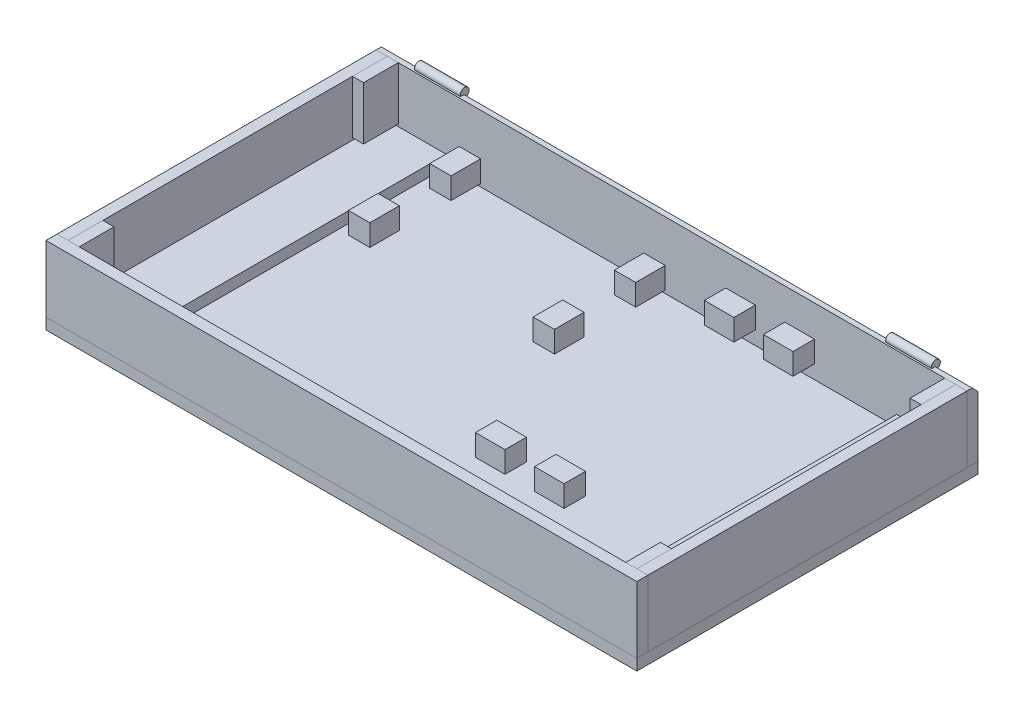
from build123d import *

# Parameters (mm, degrees)
ESQUISSE1_W             = 800
ESQUISSE1_H             = 462
BOSS_EXTRU_1_DEPTH      = 15
ESQUISSE3_W             = 800
ESQUISSE3_H             = 15
BOSS_EXTRU_3_DEPTH      = 90
BOSS_EXTRU_3_2_DEPTH    = 90
ESQUISSE4_W             = 15
ESQUISSE4_H             = 432
BOSS_EXTRU_4_DEPTH      = 90
BOSS_EXTRU_4_2_DEPTH    = 90
ESQUISSE5_W             = 15
ESQUISSE5_H             = 47
BOSS_EXTRU_5_DEPTH      = 72
BOSS_EXTRU_5_2_DEPTH    = 72
BOSS_EXTRU_5_3_DEPTH    = 72
BOSS_EXTRU_5_4_DEPTH    = 72
ESQUISSE7_W             = 80
ESQUISSE7_H             = 432
BOSS_EXTRU_6_DEPTH      = 15
BOSS_EXTRU_6_2_DEPTH    = 15
BOSS_EXTRU_7_START      = -50
ESQUISSE8_R             = 6
BOSS_EXTRU_7_DEPTH      = 62
CHANFREIN1_SIZE         = 8
ESQUISSE9_W             = 120
ESQUISSE9_H             = 29
BOSS_EXTRU_8_DEPTH      = 29
BOSS_EXTRU_8_2_DEPTH    = 29
ESQUISSE9_W_2           = 29
ESQUISSE9_H_2           = 150
BOSS_EXTRU_8_3_DEPTH    = 29
BOSS_EXTRU_8_4_DEPTH    = 29
ESQUISSE10_W            = 279
ESQUISSE10_H            = 70
ESQUISSE10_W_2          = 40
ESQUISSE10_H_2          = 339
ENL_V_MAT_EXTRU_1_DEPTH = 479.264571132


with BuildPart() as part:
    # Esquisse1 → Boss.-Extru.1 (new body)
    with BuildSketch(Plane(origin=(0, 0, 0), x_dir=(1, 0, 0), z_dir=(0, 1, 0))):
        Rectangle(ESQUISSE1_W, ESQUISSE1_H)
    extrude(amount=BOSS_EXTRU_1_DEPTH)


with BuildPart() as body_2:
    # Esquisse3 → Boss.-Extru.3 (new body)
    with BuildSketch(Plane(origin=(0, 15, 0), x_dir=(1, 0, 0), z_dir=(0, 1, 0))):
        with Locations((0, 223.5)):
            Rectangle(ESQUISSE3_W, ESQUISSE3_H)
    extrude(amount=BOSS_EXTRU_3_DEPTH)

    # Chanfrein1
    chanfrein1_edges = [body_2.edges().sort_by_distance(p)[0] for p in [
        (0, 105, -231),
    ]]
    chamfer(chanfrein1_edges, length=CHANFREIN1_SIZE)


with BuildPart() as body_3:
    # Esquisse3 → Boss.-Extru.3 2 (new body)
    with BuildSketch(Plane(origin=(0, 15, 0), x_dir=(1, 0, 0), z_dir=(0, 1, 0))):
        with Locations((0, -223.5)):
            Rectangle(ESQUISSE3_W, ESQUISSE3_H)
    extrude(amount=BOSS_EXTRU_3_2_DEPTH)


with BuildPart() as body_4:
    # Esquisse4 → Boss.-Extru.4 (new body)
    with BuildSketch(Plane(origin=(0, 15, 0), x_dir=(1, 0, 0), z_dir=(0, 1, 0))):
        with Locations((-392.5, 0)):
            Rectangle(ESQUISSE4_W, ESQUISSE4_H)
    extrude(amount=BOSS_EXTRU_4_DEPTH)


with BuildPart() as body_5:
    # Esquisse4 → Boss.-Extru.4 2 (new body)
    with BuildSketch(Plane(origin=(0, 15, 0), x_dir=(1, 0, 0), z_dir=(0, 1, 0))):
        with Locations((392.5, 0)):
            Rectangle(ESQUISSE4_W, ESQUISSE4_H)
    extrude(amount=BOSS_EXTRU_4_2_DEPTH)


with BuildPart() as body_6:
    # Esquisse5 → Boss.-Extru.5 (new body)
    with BuildSketch(Plane(origin=(0, 105, 0), x_dir=(1, 0, 0), z_dir=(0, 1, 0))):
        with Locations((-377.5, 192.5)):
            Rectangle(ESQUISSE5_W, ESQUISSE5_H)
    extrude(amount=-BOSS_EXTRU_5_DEPTH)


with BuildPart() as body_7:
    # Esquisse5 → Boss.-Extru.5 2 (new body)
    with BuildSketch(Plane(origin=(0, 105, 0), x_dir=(1, 0, 0), z_dir=(0, 1, 0))):
        with Locations((-377.5, -192.5)):
            Rectangle(ESQUISSE5_W, ESQUISSE5_H)
    extrude(amount=-BOSS_EXTRU_5_2_DEPTH)


with BuildPart() as body_8:
    # Esquisse5 → Boss.-Extru.5 3 (new body)
    with BuildSketch(Plane(origin=(0, 105, 0), x_dir=(1, 0, 0), z_dir=(0, 1, 0))):
        with Locations((377.5, -192.5)):
            Rectangle(ESQUISSE5_W, ESQUISSE5_H)
    extrude(amount=-BOSS_EXTRU_5_3_DEPTH)


with BuildPart() as body_9:
    # Esquisse5 → Boss.-Extru.5 4 (new body)
    with BuildSketch(Plane(origin=(0, 105, 0), x_dir=(1, 0, 0), z_dir=(0, 1, 0))):
        with Locations((377.5, 192.5)):
            Rectangle(ESQUISSE5_W, ESQUISSE5_H)
    extrude(amount=-BOSS_EXTRU_5_4_DEPTH)


with BuildPart() as body_10:
    # Esquisse7 → Boss.-Extru.6 (new body)
    with BuildSketch(Plane(origin=(0, 15, 0), x_dir=(1, 0, 0), z_dir=(0, 1, 0))):
        with Locations((-345, 0)):
            Rectangle(ESQUISSE7_W, ESQUISSE7_H)
    extrude(amount=BOSS_EXTRU_6_DEPTH)


with BuildPart() as body_11:
    # Esquisse7 → Boss.-Extru.6 2 (new body)
    with BuildSketch(Plane(origin=(0, 15, 0), x_dir=(1, 0, 0), z_dir=(0, 1, 0))):
        with Locations((345, 0)):
            Rectangle(ESQUISSE7_W, ESQUISSE7_H)
    extrude(amount=BOSS_EXTRU_6_2_DEPTH)


with BuildPart() as body_12:
    # Esquisse8 → Boss.-Extru.7 (new body)
    with BuildSketch(Plane.ZY.offset(400).offset(BOSS_EXTRU_7_START)):
        with Locations((-224, 107)):
            Circle(ESQUISSE8_R)
    extrude(amount=-BOSS_EXTRU_7_DEPTH)


with BuildPart() as body_13:
    # Symétrie3: mirrored copy
    add(body_12.part.mirror(Plane(origin=(0, 0, 0), x_dir=(0, 0, 1), z_dir=(1, 0, 0))))


with BuildPart() as body_14:
    # Esquisse9 → Boss.-Extru.8 (new body)
    with BuildSketch(Plane(origin=(0, 15, 0), x_dir=(1, 0, 0), z_dir=(0, 1, 0))):
        with Locations((195, 140)):
            Rectangle(ESQUISSE9_W, ESQUISSE9_H)
    extrude(amount=BOSS_EXTRU_8_DEPTH)


with BuildPart() as body_15:
    # Esquisse9 → Boss.-Extru.8 2 (new body)
    with BuildSketch(Plane(origin=(0, 15, 0), x_dir=(1, 0, 0), z_dir=(0, 1, 0))):
        with Locations((195, -170)):
            Rectangle(ESQUISSE9_W, ESQUISSE9_H)
    extrude(amount=BOSS_EXTRU_8_2_DEPTH)


with BuildPart() as body_16:
    # Esquisse9 → Boss.-Extru.8 3 (new body)
    with BuildSketch(Plane(origin=(0, 15, 0), x_dir=(1, 0, 0), z_dir=(0, 1, 0))):
        with Locations((-197, 65)):
            Rectangle(ESQUISSE9_W_2, ESQUISSE9_H_2)
    extrude(amount=BOSS_EXTRU_8_3_DEPTH)


with BuildPart() as body_17:
    # Esquisse9 → Boss.-Extru.8 4 (new body)
    with BuildSketch(Plane(origin=(0, 15, 0), x_dir=(1, 0, 0), z_dir=(0, 1, 0))):
        with Locations((53, 65)):
            Rectangle(ESQUISSE9_W_2, ESQUISSE9_H_2)
    extrude(amount=BOSS_EXTRU_8_4_DEPTH)


with BuildPart() as body_15_1:
    # Corps-Déplacer/Copier1: moved
    add(body_15.part.moved(Location((0, 80, 0))))


with BuildPart() as body_14_1:
    # Corps-Déplacer/Copier1: moved
    add(body_14.part.moved(Location((0, 80, 0))))


with BuildPart() as body_17_1:
    # Corps-Déplacer/Copier1: moved
    add(body_17.part.moved(Location((0, 80, 0))))


with BuildPart() as body_16_1:
    # Corps-Déplacer/Copier1: moved
    add(body_16.part.moved(Location((0, 80, 0))))


with BuildPart() as enl_v_mat_extru_1_tool:
    # Esquisse10 → Enlèv. mat.-Extru.1 (new, through all)
    with BuildSketch(Plane(origin=(0, 124, 0), x_dir=(1, 0, 0), z_dir=(0, 1, 0))):
        with Locations((-72, 65)):
            Rectangle(ESQUISSE10_W, ESQUISSE10_H)
        with Locations((195, -15)):
            Rectangle(ESQUISSE10_W_2, ESQUISSE10_H_2)
    extrude(amount=-ENL_V_MAT_EXTRU_1_DEPTH)


with BuildPart() as body_17_2:
    add(body_17_1.part)

    # Enlèv. mat.-Extru.1: cut by enl_v_mat_extru_1_tool
    add(enl_v_mat_extru_1_tool.part, mode=Mode.SUBTRACT)


with BuildPart() as body_16_2:
    add(body_16_1.part)

    # Enlèv. mat.-Extru.1: cut by enl_v_mat_extru_1_tool
    add(enl_v_mat_extru_1_tool.part, mode=Mode.SUBTRACT)


with BuildPart() as body_14_2:
    add(body_14_1.part)

    # Enlèv. mat.-Extru.1: cut by enl_v_mat_extru_1_tool
    add(enl_v_mat_extru_1_tool.part, mode=Mode.SUBTRACT)


with BuildPart() as body_15_2:
    add(body_15_1.part)

    # Enlèv. mat.-Extru.1: cut by enl_v_mat_extru_1_tool
    add(enl_v_mat_extru_1_tool.part, mode=Mode.SUBTRACT)


with BuildPart() as enl_v_mat_extru_1_piece_1:
    # of the separate pieces the step leaves, piece 1, a body of its own (enl_v_mat_extru_1_pieces)
    add(body_14_2.part.solids().sort_by_distance((135, 95, -154.5))[0])


with BuildPart() as enl_v_mat_extru_1_piece_2:
    # of the separate pieces the step leaves, piece 2, a body of its own (enl_v_mat_extru_1_pieces)
    add(body_14_2.part.solids().sort_by_distance((215, 95, -154.5))[0])


with BuildPart() as enl_v_mat_extru_1_piece_1_of_body_15:
    # of the separate pieces the step leaves, piece 1, a body of its own (enl_v_mat_extru_1_pieces_of_body_15)
    add(body_15_2.part.solids().sort_by_distance((135, 95, 184.5))[0])


with BuildPart() as enl_v_mat_extru_1_piece_2_of_body_15:
    # of the separate pieces the step leaves, piece 2, a body of its own (enl_v_mat_extru_1_pieces_of_body_15)
    add(body_15_2.part.solids().sort_by_distance((255, 95, 184.5))[0])


with BuildPart() as enl_v_mat_extru_1_piece_1_of_body_16:
    # of the separate pieces the step leaves, piece 1, a body of its own (enl_v_mat_extru_1_pieces_of_body_16)
    add(body_16_2.part.solids().sort_by_distance((-211.5, 95, -140))[0])


with BuildPart() as enl_v_mat_extru_1_piece_2_of_body_16:
    # of the separate pieces the step leaves, piece 2, a body of its own (enl_v_mat_extru_1_pieces_of_body_16)
    add(body_16_2.part.solids().sort_by_distance((-211.5, 95, 10))[0])


with BuildPart() as enl_v_mat_extru_1_piece_1_of_body_17:
    # of the separate pieces the step leaves, piece 1, a body of its own (enl_v_mat_extru_1_pieces_of_body_17)
    add(body_17_2.part.solids().sort_by_distance((38.5, 95, -140))[0])


with BuildPart() as enl_v_mat_extru_1_piece_2_of_body_17:
    # of the separate pieces the step leaves, piece 2, a body of its own (enl_v_mat_extru_1_pieces_of_body_17)
    add(body_17_2.part.solids().sort_by_distance((38.5, 95, -30))[0])


solid = Compound([part.part, body_2.part, body_3.part, body_4.part, body_5.part, body_6.part, body_7.part, body_8.part, body_9.part, body_10.part, body_11.part, body_12.part, body_13.part, enl_v_mat_extru_1_piece_1.part, enl_v_mat_extru_1_piece_2.part, enl_v_mat_extru_1_piece_1_of_body_15.part, enl_v_mat_extru_1_piece_2_of_body_15.part, enl_v_mat_extru_1_piece_1_of_body_16.part, enl_v_mat_extru_1_piece_2_of_body_16.part, enl_v_mat_extru_1_piece_1_of_body_17.part, enl_v_mat_extru_1_piece_2_of_body_17.part])
